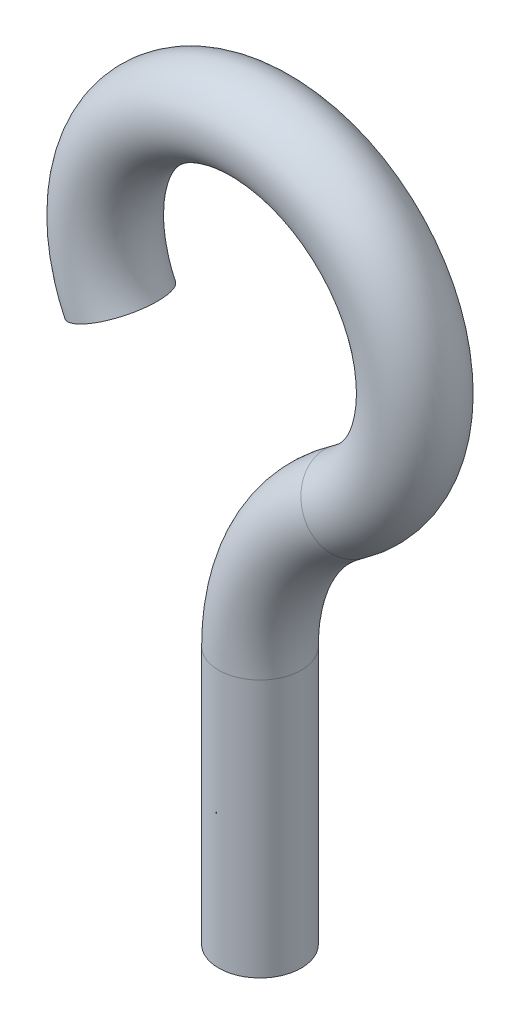
from build123d import *

# Parameters (mm, degrees)
IZIM4_R   = 4
IZIM4_R_2 = 3


with BuildPart() as part:
    # Süpür1: sweep along a path in Çizim3
    with BuildLine(Plane.XY) as s_p_r1_path:
        Line((0, 0), (0, 25))
        ThreePointArc((0, 25), (2.271894791, 34.258200998), (8.571428571, 41.413036133))
        ThreePointArc((8.571428571, 41.413036133), (3.84127611, 68.22262695), (-13.541672839, 47.271216785))
    # Çizim4 → Süpür1 (sweep)
    with BuildSketch(Plane(origin=(0, 0, 0), x_dir=(1, 0, 0), z_dir=(0, 1, 0))):
        Circle(IZIM4_R)
        Circle(IZIM4_R_2, mode=Mode.SUBTRACT)
    sweep(path=s_p_r1_path.line)


solid = part.part
